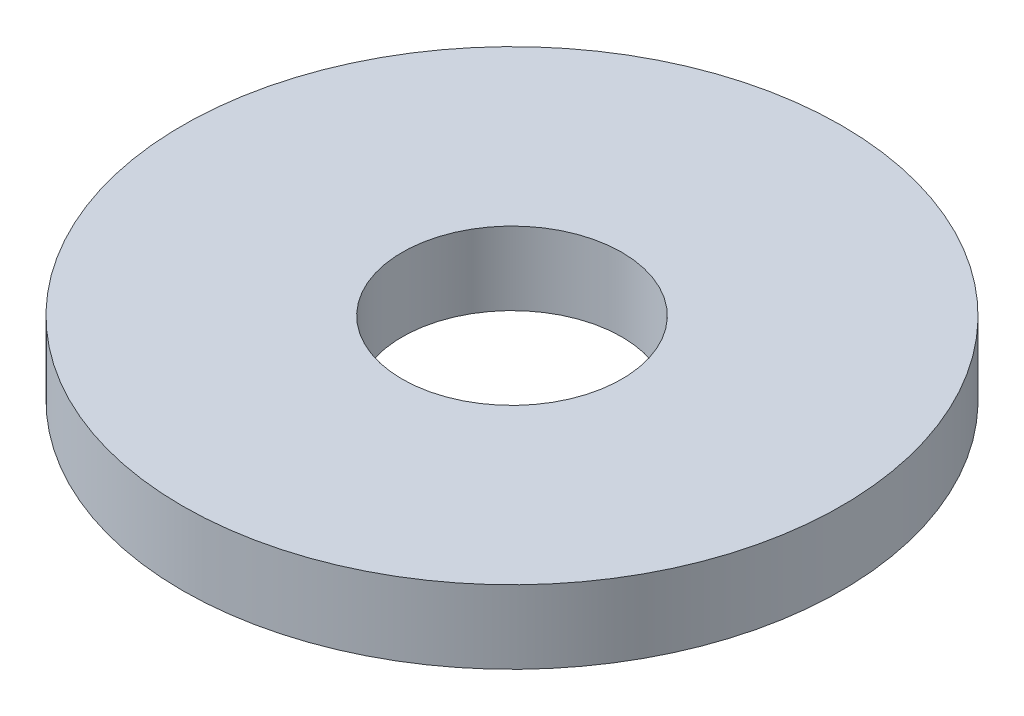
from build123d import *

# Parameters (mm, degrees)
CROQUIS1_R              = 4.5
CROQUIS1_R_2            = 1.5
SALIENTE_EXTRUIR1_DEPTH = 1


with BuildPart() as part:
    # Croquis1 → Saliente-Extruir1 (new body)
    with BuildSketch(Plane(origin=(0, 0, 0), x_dir=(1, 0, 0), z_dir=(0, 1, 0))):
        with Locations(Location((0, 0, 0), (0, 0, 270))):
            Circle(CROQUIS1_R)
        with Locations(Location((0, 0, 0), (0, 0, 270))):
            Circle(CROQUIS1_R_2, mode=Mode.SUBTRACT)
    extrude(amount=SALIENTE_EXTRUIR1_DEPTH)


solid = part.part
